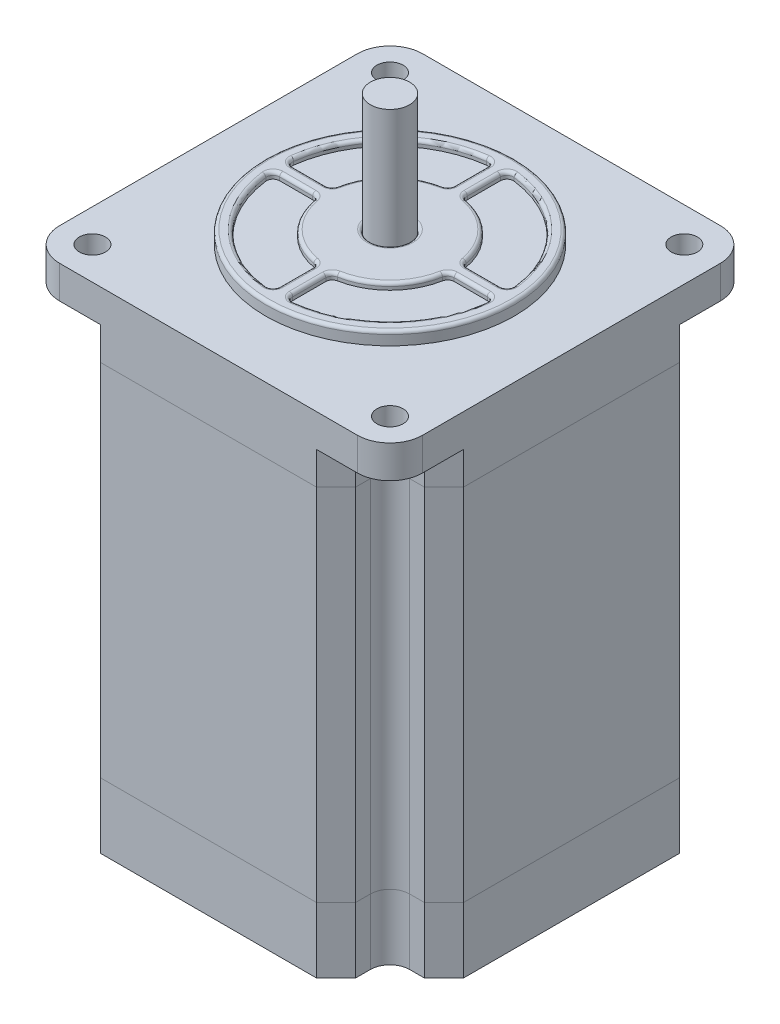
from build123d import *

# Parameters (mm, degrees)
SKETCH1_R               = 3
BOSS_EXTRUDE1_DEPTH     = 10
SKETCH2_R               = 3
BOSS_EXTRUDE2_DEPTH     = 55
SKETCH3_R               = 3
BOSS_EXTRUDE3_DEPTH     = 10
BOSS_EXTRUDE4_DEPTH     = 5
CUT_EXTRUDE1_START      = -5
SKETCH5_R               = 2
SKETCH5_R_2             = 3
CUT_EXTRUDE1_DEPTH      = 5
SKETCH8_R               = 19
BOSS_EXTRUDE5_DEPTH     = 2
CUT_EXTRUDE2_DEPTH      = 2
CUT_EXTRUDE2_DEPTH_BACK = 2
SKETCH9_R               = 3
FILLET1_R               = 0.5
SKETCH10_R              = 19
BOSS_EXTRUDE6_DEPTH     = 1
CUT_EXTRUDE3_START      = -11
SKETCH11_R              = 3
CUT_EXTRUDE3_DEPTH      = 11
SKETCH12_R              = 3
BOSS_EXTRUDE7_DEPTH     = 105


with BuildPart() as part:
    # Sketch1 → Boss-Extrude1 (new body)
    with BuildSketch(Plane(origin=(0, 0, 0), x_dir=(1, 0, 0), z_dir=(0, 1, 0))):
        with BuildLine():
            Line((0, 44.25), (3, 47.25))
            Line((3, 47.25), (5.25, 47.25))
            ThreePointArc((5.25, 47.25), (7.371320344, 48.128679656), (8.25, 50.25))
            Line((8.25, 50.25), (8.25, 52.5))
            Line((8.25, 52.5), (11.25, 55.5))
            Line((11.25, 55.5), (44.25, 55.5))
            Line((44.25, 55.5), (47.25, 52.5))
            Line((47.25, 52.5), (47.25, 50.25))
            ThreePointArc((47.25, 50.25), (48.128679656, 48.128679656), (50.25, 47.25))
            Line((50.25, 47.25), (52.5, 47.25))
            Line((52.5, 47.25), (55.5, 44.25))
            Line((55.5, 44.25), (55.5, 11.25))
            Line((55.5, 11.25), (52.5, 8.25))
            Line((52.5, 8.25), (50.25, 8.25))
            ThreePointArc((50.25, 8.25), (48.128679656, 7.371320344), (47.25, 5.25))
            Line((47.25, 5.25), (47.25, 3))
            Line((47.25, 3), (44.25, 0))
            Line((44.25, 0), (11.25, 0))
            Line((11.25, 0), (8.25, 3))
            Line((8.25, 3), (8.25, 5.25))
            ThreePointArc((8.25, 5.25), (7.371320344, 7.371320344), (5.25, 8.25))
            Line((5.25, 8.25), (3, 8.25))
            Line((3, 8.25), (0, 11.25))
            Line((0, 11.25), (0, 44.25))
        make_face()
        with Locations(Location((27.75, 27.75, 0), (0, 0, 270))):
            Circle(SKETCH1_R, mode=Mode.SUBTRACT)
    extrude(amount=BOSS_EXTRUDE1_DEPTH)


with BuildPart() as body_2:
    # Sketch2 → Boss-Extrude2 (new body)
    with BuildSketch(Plane(origin=(0, 10, 0), x_dir=(1, 0, 0), z_dir=(0, 1, 0))):
        with BuildLine():
            Line((0, 44.25), (0, 11.25))
            Line((0, 11.25), (3, 8.25))
            Line((3, 8.25), (5.25, 8.25))
            ThreePointArc((5.25, 8.25), (7.371320344, 7.371320344), (8.25, 5.25))
            Line((8.25, 5.25), (8.25, 3))
            Line((8.25, 3), (11.25, 0))
            Line((11.25, 0), (44.25, 0))
            Line((44.25, 0), (47.25, 3))
            Line((47.25, 3), (47.25, 5.25))
            ThreePointArc((47.25, 5.25), (48.128679656, 7.371320344), (50.25, 8.25))
            Line((50.25, 8.25), (52.5, 8.25))
            Line((52.5, 8.25), (55.5, 11.25))
            Line((55.5, 11.25), (55.5, 44.25))
            Line((55.5, 44.25), (52.5, 47.25))
            Line((52.5, 47.25), (50.25, 47.25))
            ThreePointArc((50.25, 47.25), (48.128679656, 48.128679656), (47.25, 50.25))
            Line((47.25, 50.25), (47.25, 52.5))
            Line((47.25, 52.5), (44.25, 55.5))
            Line((44.25, 55.5), (11.25, 55.5))
            Line((11.25, 55.5), (8.25, 52.5))
            Line((8.25, 52.5), (8.25, 50.25))
            ThreePointArc((8.25, 50.25), (7.371320344, 48.128679656), (5.25, 47.25))
            Line((5.25, 47.25), (3, 47.25))
            Line((3, 47.25), (0, 44.25))
        make_face()
        with Locations(Location((27.75, 27.75, 0), (0, 0, 270))):
            Circle(SKETCH2_R, mode=Mode.SUBTRACT)
    extrude(amount=BOSS_EXTRUDE2_DEPTH)


with BuildPart() as body_3:
    # Sketch3 → Boss-Extrude3 (new body)
    with BuildSketch(Plane(origin=(0, 65, 0), x_dir=(1, 0, 0), z_dir=(0, 1, 0))):
        with BuildLine():
            Line((0, 44.25), (3, 47.25))
            Line((3, 47.25), (5.25, 47.25))
            ThreePointArc((5.25, 47.25), (7.371320344, 48.128679656), (8.25, 50.25))
            Line((8.25, 50.25), (8.25, 52.5))
            Line((8.25, 52.5), (11.25, 55.5))
            Line((11.25, 55.5), (44.25, 55.5))
            Line((44.25, 55.5), (47.25, 52.5))
            Line((47.25, 52.5), (47.25, 50.25))
            ThreePointArc((47.25, 50.25), (48.128679656, 48.128679656), (50.25, 47.25))
            Line((50.25, 47.25), (52.5, 47.25))
            Line((52.5, 47.25), (55.5, 44.25))
            Line((55.5, 44.25), (55.5, 11.25))
            Line((55.5, 11.25), (52.5, 8.25))
            Line((52.5, 8.25), (50.25, 8.25))
            ThreePointArc((50.25, 8.25), (48.128679656, 7.371320344), (47.25, 5.25))
            Line((47.25, 5.25), (47.25, 3))
            Line((47.25, 3), (44.25, 0))
            Line((44.25, 0), (11.25, 0))
            Line((11.25, 0), (8.25, 3))
            Line((8.25, 3), (8.25, 5.25))
            ThreePointArc((8.25, 5.25), (7.371320344, 7.371320344), (5.25, 8.25))
            Line((5.25, 8.25), (3, 8.25))
            Line((3, 8.25), (0, 11.25))
            Line((0, 11.25), (0, 44.25))
        make_face()
        with Locations(Location((27.75, 27.75, 0), (0, 0, 270))):
            Circle(SKETCH3_R, mode=Mode.SUBTRACT)
    extrude(amount=BOSS_EXTRUDE3_DEPTH)

    # Sketch4 → Boss-Extrude4 (add)
    with BuildSketch(Plane(origin=(0, 75, 0), x_dir=(1, 0, 0), z_dir=(0, 1, 0))):
        with BuildLine():
            Line((5, 0), (50.5, 0))
            ThreePointArc((50.5, 0), (54.035533906, 1.464466094), (55.5, 5))
            Line((55.5, 5), (55.5, 50.5))
            ThreePointArc((55.5, 50.5), (54.035533906, 54.035533906), (50.5, 55.5))
            Line((50.5, 55.5), (5, 55.5))
            ThreePointArc((5, 55.5), (1.464466094, 54.035533906), (0, 50.5))
            Line((0, 50.5), (0, 5))
            ThreePointArc((0, 5), (1.464466094, 1.464466094), (5, 0))
        make_face()
    extrude(amount=-BOSS_EXTRUDE4_DEPTH)

    # Sketch5 → Cut-Extrude1 (cut)
    with BuildSketch(Plane(origin=(0, 75, 0), x_dir=(1, 0, 0), z_dir=(0, 1, 0)).offset(CUT_EXTRUDE1_START)):
        with Locations(Location((5, 50.5, 0), (0, 0, 270))):
            Circle(SKETCH5_R)
        with Locations(Location((50.25, 50.25, 0), (0, 0, 270))):
            Circle(SKETCH5_R)
        with Locations(Location((5, 5, 0), (0, 0, 270))):
            Circle(SKETCH5_R)
        with Locations(Location((50.5, 5, 0), (0, 0, 270))):
            Circle(SKETCH5_R)
        with Locations(Location((27.75, 27.75, 0), (0, 0, 270))):
            Circle(SKETCH5_R_2)
    extrude(amount=CUT_EXTRUDE1_DEPTH, mode=Mode.SUBTRACT)

    # Sketch8 → Boss-Extrude5 (add)
    with BuildSketch(Plane(origin=(0, 75, 0), x_dir=(1, 0, 0), z_dir=(0, 1, 0))):
        with Locations(Location((27.75, 27.75, 0), (0, 0, 90))):
            Circle(SKETCH8_R)
        with BuildLine():
            Line((38.566653826, 28.75), (43.624507866, 28.75))
            ThreePointArc((43.624507866, 28.75), (44.374507866, 29.088562172), (44.616664608, 29.875))
            ThreePointArc((44.616664608, 29.875), (39.77081528, 39.77081528), (29.875, 44.616664608))
            ThreePointArc((29.875, 44.616664608), (29.088562172, 44.374507866), (28.75, 43.624507866))
            Line((28.75, 43.624507866), (28.75, 38.566653826))
            ThreePointArc((28.75, 38.566653826), (28.981293885, 37.927051677), (29.568181818, 37.58332166))
            ThreePointArc((29.568181818, 37.58332166), (34.821067812, 34.821067812), (37.58332166, 29.568181818))
            ThreePointArc((37.58332166, 29.568181818), (37.927051677, 28.981293885), (38.566653826, 28.75))
        make_face(mode=Mode.SUBTRACT)
        with BuildLine():
            Line((11.875492134, 28.75), (16.933346174, 28.75))
            ThreePointArc((16.933346174, 28.75), (17.572948323, 28.981293885), (17.91667834, 29.568181818))
            ThreePointArc((17.91667834, 29.568181818), (20.678932188, 34.821067812), (25.931818182, 37.58332166))
            ThreePointArc((25.931818182, 37.58332166), (26.518706115, 37.927051677), (26.75, 38.566653826))
            Line((26.75, 38.566653826), (26.75, 43.624507866))
            ThreePointArc((26.75, 43.624507866), (26.411437828, 44.374507866), (25.625, 44.616664608))
            ThreePointArc((25.625, 44.616664608), (15.72918472, 39.77081528), (10.883335392, 29.875))
            ThreePointArc((10.883335392, 29.875), (11.125492134, 29.088562172), (11.875492134, 28.75))
        make_face(mode=Mode.SUBTRACT)
        with BuildLine():
            Line((26.75, 16.933346174), (26.75, 11.875492134))
            ThreePointArc((26.75, 11.875492134), (26.411437828, 11.125492134), (25.625, 10.883335392))
            ThreePointArc((25.625, 10.883335392), (15.72918472, 15.72918472), (10.883335392, 25.625))
            ThreePointArc((10.883335392, 25.625), (11.125492134, 26.411437828), (11.875492134, 26.75))
            Line((11.875492134, 26.75), (16.933346174, 26.75))
            ThreePointArc((16.933346174, 26.75), (17.572948323, 26.518706115), (17.91667834, 25.931818182))
            ThreePointArc((17.91667834, 25.931818182), (20.678932188, 20.678932188), (25.931818182, 17.91667834))
            ThreePointArc((25.931818182, 17.91667834), (26.518706115, 17.572948323), (26.75, 16.933346174))
        make_face(mode=Mode.SUBTRACT)
        with BuildLine():
            Line((28.75, 16.933346174), (28.75, 11.875492134))
            ThreePointArc((28.75, 11.875492134), (29.088562172, 11.125492134), (29.875, 10.883335392))
            ThreePointArc((29.875, 10.883335392), (39.77081528, 15.72918472), (44.616664608, 25.625))
            ThreePointArc((44.616664608, 25.625), (44.374507866, 26.411437828), (43.624507866, 26.75))
            Line((43.624507866, 26.75), (38.566653826, 26.75))
            ThreePointArc((38.566653826, 26.75), (37.927051677, 26.518706115), (37.58332166, 25.931818182))
            ThreePointArc((37.58332166, 25.931818182), (34.821067812, 20.678932188), (29.568181818, 17.91667834))
            ThreePointArc((29.568181818, 17.91667834), (28.981293885, 17.572948323), (28.75, 16.933346174))
        make_face(mode=Mode.SUBTRACT)
    extrude(amount=BOSS_EXTRUDE5_DEPTH)

    # Sketch9 → Cut-Extrude2 (cut, two sides: drawn at the far end of the back side and taken through both)
    with BuildSketch(Plane(origin=(0, 77, 0), x_dir=(1, 0, 0), z_dir=(0, 1, 0)).offset(-CUT_EXTRUDE2_DEPTH_BACK)):
        with Locations(Location((27.75, 27.75, 0), (0, 0, 270))):
            Circle(SKETCH9_R)
    extrude(amount=CUT_EXTRUDE2_DEPTH + CUT_EXTRUDE2_DEPTH_BACK, mode=Mode.SUBTRACT)

    # Fillet1
    fillet1_edges = [body_3.edges().sort_by_distance(p)[0] for p in [
        (27.75, 77, -8.75),
        (11.125492134, 77, -26.411437828),
        (15.72918472, 77, -15.72918472),
        (26.411437828, 77, -11.125492134),
        (26.75, 77, -14.404419154),
        (26.518706115, 77, -17.572948323),
        (20.678932188, 77, -20.678932188),
        (17.572948323, 77, -26.518706115),
        (14.404419154, 77, -26.75),
        (28.981293885, 77, -17.572948323),
        (28.75, 77, -14.404419154),
        (29.088562172, 77, -11.125492134),
        (39.77081528, 77, -15.72918472),
        (44.374507866, 77, -26.411437828),
        (41.095580846, 77, -26.75),
        (37.927051677, 77, -26.518706115),
        (34.821067812, 77, -20.678932188),
        (37.927051677, 77, -28.981293885),
        (41.095580846, 77, -28.75),
        (44.374507866, 77, -29.088562172),
        (39.77081528, 77, -39.77081528),
        (29.088562172, 77, -44.374507866),
        (28.75, 77, -41.095580846),
        (28.981293885, 77, -37.927051677),
        (34.821067812, 77, -34.821067812),
        (26.518706115, 77, -37.927051677),
        (26.75, 77, -41.095580846),
        (26.411437828, 77, -44.374507866),
        (15.72918472, 77, -39.77081528),
        (11.125492134, 77, -29.088562172),
        (14.404419154, 77, -28.75),
        (17.572948323, 77, -28.981293885),
        (20.678932188, 77, -34.821067812),
        (27.75, 77, -30.75),
    ]]
    fillet(fillet1_edges, radius=FILLET1_R)

    # Sketch10 → Boss-Extrude6 (add)
    with BuildSketch(Plane(origin=(0, 75, 0), x_dir=(1, 0, 0), z_dir=(0, 1, 0))):
        with Locations(Location((27.75, 27.75, 0), (0, 0, 90))):
            Circle(SKETCH10_R)
    extrude(amount=BOSS_EXTRUDE6_DEPTH)

    # Sketch11 → Cut-Extrude3 (cut)
    with BuildSketch(Plane(origin=(0, 76, 0), x_dir=(1, 0, 0), z_dir=(0, 1, 0)).offset(CUT_EXTRUDE3_START)):
        with Locations(Location((27.75, 27.75, 0), (0, 0, 270))):
            Circle(SKETCH11_R)
    extrude(amount=CUT_EXTRUDE3_DEPTH, mode=Mode.SUBTRACT)


with BuildPart() as body_4:
    # Sketch12 → Boss-Extrude7 (new body)
    with BuildSketch(Plane(origin=(0, -10, 0), x_dir=(-1, 0, 0), z_dir=(0, -1, 0))):
        with Locations(Location((-27.75, 27.75, 0), (0, 0, 90))):
            Circle(SKETCH12_R)
    extrude(amount=-BOSS_EXTRUDE7_DEPTH)


solid = Compound([part.part, body_2.part, body_3.part, body_4.part])
